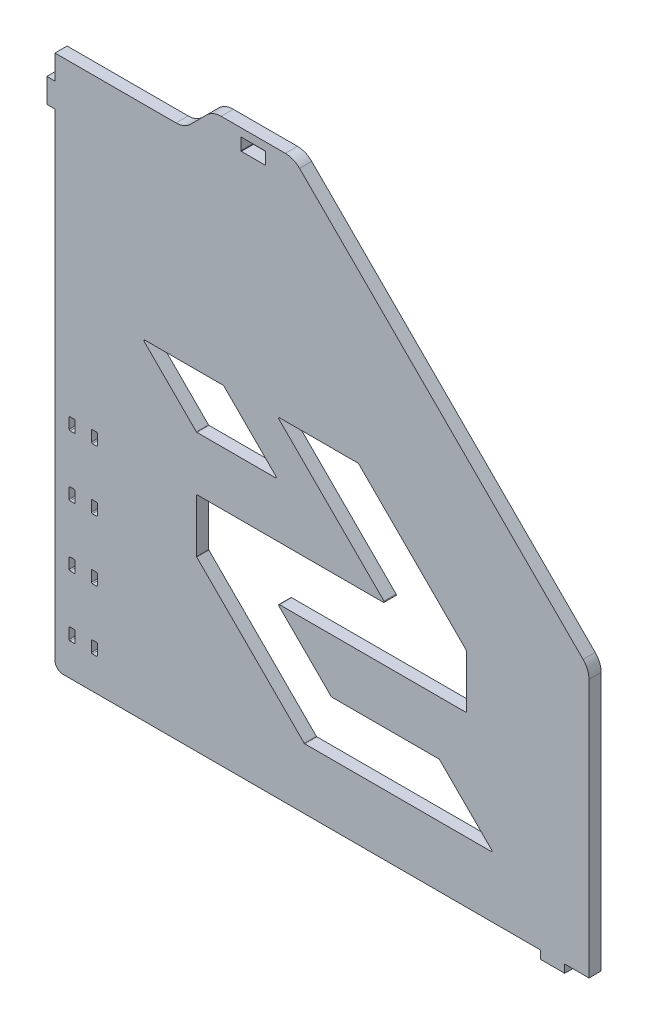
from build123d import *

# Parameters (mm, degrees)
BOSS_EXTRUDE1_DEPTH = 3
CUT_EXTRUDE2_REACH  = 101.081
CUT_EXTRUDE3_REACH  = 101.081
FILLET1_R           = 5
FILLET2_R           = 2
FILLET4_R           = 0.2


with BuildPart() as part:
    # Sketch1 → Boss-Extrude1 (new body)
    with BuildSketch(Plane.XY):
        Polygon((-34, 65), (-66, 65), (-66, 59), (-68, 59), (-68, 53), (-66, 53), (-66, -67), (54, -67), (54, -69), (60, -69), (60, -67), (66, -67), (66, -1), (-7, 72), (-27, 72), align=None)
        with BuildLine():
            ThreePointArc((-20.025, 69.925), (-20.018541435, 69.960355339), (-20, 69.991143783))
            Line((-20, 69.991143783), (-20, 70))
            Line((-20, 70), (-19.991143783, 70))
            ThreePointArc((-19.991143783, 70), (-19.960355339, 70.018541435), (-19.925, 70.025))
            Line((-19.925, 70.025), (-14.075, 70.025))
            ThreePointArc((-14.075, 70.025), (-14.039644661, 70.018541435), (-14.008856217, 70))
            Line((-14.008856217, 70), (-14, 70))
            Line((-14, 70), (-14, 69.991143783))
            ThreePointArc((-14, 69.991143783), (-13.981458565, 69.960355339), (-13.975, 69.925))
            Line((-13.975, 69.925), (-13.975, 67.075))
            ThreePointArc((-13.975, 67.075), (-13.981458565, 67.039644661), (-14, 67.008856217))
            Line((-14, 67.008856217), (-14, 67))
            Line((-14, 67), (-14.008856217, 67))
            ThreePointArc((-14.008856217, 67), (-14.039644661, 66.981458565), (-14.075, 66.975))
            Line((-14.075, 66.975), (-19.925, 66.975))
            ThreePointArc((-19.925, 66.975), (-19.960355339, 66.981458565), (-19.991143783, 67))
            Line((-19.991143783, 67), (-20, 67))
            Line((-20, 67), (-20, 67.008856217))
            ThreePointArc((-20, 67.008856217), (-20.018541435, 67.039644661), (-20.025, 67.075))
            Line((-20.025, 67.075), (-20.025, 69.925))
        make_face(mode=Mode.SUBTRACT)
    extrude(amount=BOSS_EXTRUDE1_DEPTH)

    # Sketch6 → Cut-Extrude2 (cut, up to next)
    with BuildSketch(Plane(origin=(0, 0, 0), x_dir=(-1, 0, 0), z_dir=(0, 0, -1)), mode=Mode.PRIVATE) as cut_extrude2_sk1:
        Polygon((31, 14.666666667), (17.666666667, 1.333333333), (31, 1.333333333), (44.333333333, 14.666666667), align=None)
    cut_extrude2_tool1 = extrude(cut_extrude2_sk1.sketch, amount=-CUT_EXTRUDE2_REACH, mode=Mode.PRIVATE) & part.part
    # Sketch6 → Cut-Extrude2 (cut, up to next)
    with BuildSketch(Plane(origin=(0, 0, 0), x_dir=(-1, 0, 0), z_dir=(0, 0, -1)), mode=Mode.PRIVATE) as cut_extrude2_sk2:
        Polygon((24.333333333, 14.666666667), (11, 1.333333333), (17.666666667, 1.333333333), (31, 14.666666667), align=None)
    cut_extrude2_tool2 = extrude(cut_extrude2_sk2.sketch, amount=-CUT_EXTRUDE2_REACH, mode=Mode.PRIVATE) & part.part
    # Sketch6 → Cut-Extrude2 (cut, up to next)
    with BuildSketch(Plane(origin=(0, 0, 0), x_dir=(-1, 0, 0), z_dir=(0, 0, -1)), mode=Mode.PRIVATE) as cut_extrude2_sk3:
        Polygon((-9, 14.666666667), (-22.333333333, 1.333333333), (-2.333333333, 1.333333333), (11, 14.666666667), align=None)
    cut_extrude2_tool3 = extrude(cut_extrude2_sk3.sketch, amount=-CUT_EXTRUDE2_REACH, mode=Mode.PRIVATE) & part.part
    # Sketch6 → Cut-Extrude2 (cut, up to next)
    with BuildSketch(Plane(origin=(0, 0, 0), x_dir=(-1, 0, 0), z_dir=(0, 0, -1)), mode=Mode.PRIVATE) as cut_extrude2_sk4:
        Polygon((-22.333333333, 1.333333333), (-35.666666667, -12), (-15.666666667, -12), (-2.333333333, 1.333333333), align=None)
    cut_extrude2_tool4 = extrude(cut_extrude2_sk4.sketch, amount=-CUT_EXTRUDE2_REACH, mode=Mode.PRIVATE) & part.part
    # Sketch6 → Cut-Extrude2 (cut, up to next)
    with BuildSketch(Plane(origin=(0, 0, 0), x_dir=(-1, 0, 0), z_dir=(0, 0, -1)), mode=Mode.PRIVATE) as cut_extrude2_sk5:
        Polygon((-35.666666667, -25.333333333), (-29, -25.333333333), (-15.666666667, -12), (-35.666666667, -12), align=None)
    cut_extrude2_tool5 = extrude(cut_extrude2_sk5.sketch, amount=-CUT_EXTRUDE2_REACH, mode=Mode.PRIVATE) & part.part
    # Sketch6 → Cut-Extrude2 (cut, up to next)
    with BuildSketch(Plane(origin=(0, 0, 0), x_dir=(-1, 0, 0), z_dir=(0, 0, -1)), mode=Mode.PRIVATE) as cut_extrude2_sk6:
        Polygon((-15.666666667, -12), (-29, -25.333333333), (-9, -25.333333333), (4.333333333, -12), align=None)
    cut_extrude2_tool6 = extrude(cut_extrude2_sk6.sketch, amount=-CUT_EXTRUDE2_REACH, mode=Mode.PRIVATE) & part.part
    # Sketch6 → Cut-Extrude2 (cut, up to next)
    with BuildSketch(Plane(origin=(0, 0, 0), x_dir=(-1, 0, 0), z_dir=(0, 0, -1)), mode=Mode.PRIVATE) as cut_extrude2_sk7:
        Polygon((4.333333333, -12), (-9, -25.333333333), (11, -25.333333333), (24.333333333, -12), align=None)
    cut_extrude2_tool7 = extrude(cut_extrude2_sk7.sketch, amount=-CUT_EXTRUDE2_REACH, mode=Mode.PRIVATE) & part.part
    # Sketch6 → Cut-Extrude2 (cut, up to next)
    with BuildSketch(Plane(origin=(0, 0, 0), x_dir=(-1, 0, 0), z_dir=(0, 0, -1)), mode=Mode.PRIVATE) as cut_extrude2_sk8:
        Polygon((24.333333333, -12), (11, -25.333333333), (31, -25.333333333), (31, -12), align=None)
    cut_extrude2_tool8 = extrude(cut_extrude2_sk8.sketch, amount=-CUT_EXTRUDE2_REACH, mode=Mode.PRIVATE) & part.part
    # Sketch6 → Cut-Extrude2 (cut, up to next)
    with BuildSketch(Plane(origin=(0, 0, 0), x_dir=(-1, 0, 0), z_dir=(0, 0, -1)), mode=Mode.PRIVATE) as cut_extrude2_sk9:
        Polygon((11, -25.333333333), (-2.333333333, -38.666666667), (17.666666667, -38.666666667), (31, -25.333333333), align=None)
    cut_extrude2_tool9 = extrude(cut_extrude2_sk9.sketch, amount=-CUT_EXTRUDE2_REACH, mode=Mode.PRIVATE) & part.part
    # Sketch6 → Cut-Extrude2 (cut, up to next)
    with BuildSketch(Plane(origin=(0, 0, 0), x_dir=(-1, 0, 0), z_dir=(0, 0, -1)), mode=Mode.PRIVATE) as cut_extrude2_sk10:
        Polygon((-2.333333333, -38.666666667), (-15.666666667, -52), (4.333333333, -52), (17.666666667, -38.666666667), align=None)
    cut_extrude2_tool10 = extrude(cut_extrude2_sk10.sketch, amount=-CUT_EXTRUDE2_REACH, mode=Mode.PRIVATE) & part.part
    # Sketch6 → Cut-Extrude2 (cut, up to next)
    with BuildSketch(Plane(origin=(0, 0, 0), x_dir=(-1, 0, 0), z_dir=(0, 0, -1)), mode=Mode.PRIVATE) as cut_extrude2_sk11:
        Polygon((-22.333333333, -38.666666667), (-35.666666667, -52), (-15.666666667, -52), (-2.333333333, -38.666666667), align=None)
    cut_extrude2_tool11 = extrude(cut_extrude2_sk11.sketch, amount=-CUT_EXTRUDE2_REACH, mode=Mode.PRIVATE) & part.part
    # Sketch6 → Cut-Extrude2 (cut, up to next)
    with BuildSketch(Plane(origin=(0, 0, 0), x_dir=(-1, 0, 0), z_dir=(0, 0, -1)), mode=Mode.PRIVATE) as cut_extrude2_sk12:
        Polygon((-29, -38.666666667), (-42.333333333, -52), (-35.666666667, -52), (-22.333333333, -38.666666667), align=None)
    cut_extrude2_tool12 = extrude(cut_extrude2_sk12.sketch, amount=-CUT_EXTRUDE2_REACH, mode=Mode.PRIVATE) & part.part
    add(cut_extrude2_tool1.solids().sort_by_distance((-31, 8, 0))[0], mode=Mode.SUBTRACT)
    add(cut_extrude2_tool2.solids().sort_by_distance((-21, 8, 0))[0], mode=Mode.SUBTRACT)
    add(cut_extrude2_tool3.solids().sort_by_distance((5.666667, 8, 0))[0], mode=Mode.SUBTRACT)
    add(cut_extrude2_tool4.solids().sort_by_distance((19, -5.333333, 0))[0], mode=Mode.SUBTRACT)
    add(cut_extrude2_tool5.solids().sort_by_distance((28.444444, -17.555556, 0))[0], mode=Mode.SUBTRACT)
    add(cut_extrude2_tool6.solids().sort_by_distance((12.333333, -18.666667, 0))[0], mode=Mode.SUBTRACT)
    add(cut_extrude2_tool7.solids().sort_by_distance((-7.666667, -18.666667, 0))[0], mode=Mode.SUBTRACT)
    add(cut_extrude2_tool8.solids().sort_by_distance((-23.777778, -19.777778, 0))[0], mode=Mode.SUBTRACT)
    add(cut_extrude2_tool9.solids().sort_by_distance((-14.333333, -32, 0))[0], mode=Mode.SUBTRACT)
    add(cut_extrude2_tool10.solids().sort_by_distance((-1, -45.333333, 0))[0], mode=Mode.SUBTRACT)
    add(cut_extrude2_tool11.solids().sort_by_distance((19, -45.333333, 0))[0], mode=Mode.SUBTRACT)
    add(cut_extrude2_tool12.solids().sort_by_distance((32.333333, -45.333333, 0))[0], mode=Mode.SUBTRACT)

    # Sketch7 → Cut-Extrude3 (cut, up to next)
    with BuildSketch(Plane.XY.offset(3), mode=Mode.PRIVATE) as cut_extrude3_sk1:
        with BuildLine():
            Line((-61, -58.75), (-61, -56.25))
            ThreePointArc((-61, -56.25), (-61.073223305, -56.073223305), (-61.25, -56))
            Line((-61.25, -56), (-62.25, -56))
            ThreePointArc((-62.25, -56), (-62.426776695, -56.073223305), (-62.5, -56.25))
            Line((-62.5, -56.25), (-62.5, -58.75))
            ThreePointArc((-62.5, -58.75), (-62.426776695, -58.926776695), (-62.25, -59))
            Line((-62.25, -59), (-61.25, -59))
            ThreePointArc((-61.25, -59), (-61.073223305, -58.926776695), (-61, -58.75))
        make_face()
    cut_extrude3_tool1 = extrude(cut_extrude3_sk1.sketch, amount=-CUT_EXTRUDE3_REACH, mode=Mode.PRIVATE) & part.part
    # Sketch7 → Cut-Extrude3 (cut, up to next)
    with BuildSketch(Plane.XY.offset(3), mode=Mode.PRIVATE) as cut_extrude3_sk2:
        with BuildLine():
            ThreePointArc((-56.75, -56), (-56.926776695, -56.073223305), (-57, -56.25))
            Line((-57, -56.25), (-57, -58.75))
            ThreePointArc((-57, -58.75), (-56.926776695, -58.926776695), (-56.75, -59))
            Line((-56.75, -59), (-55.75, -59))
            ThreePointArc((-55.75, -59), (-55.573223305, -58.926776695), (-55.5, -58.75))
            Line((-55.5, -58.75), (-55.5, -56.25))
            ThreePointArc((-55.5, -56.25), (-55.573223305, -56.073223305), (-55.75, -56))
            Line((-55.75, -56), (-56.75, -56))
        make_face()
    cut_extrude3_tool2 = extrude(cut_extrude3_sk2.sketch, amount=-CUT_EXTRUDE3_REACH, mode=Mode.PRIVATE) & part.part
    # Sketch7 → Cut-Extrude3 (cut, up to next)
    with BuildSketch(Plane.XY.offset(3), mode=Mode.PRIVATE) as cut_extrude3_sk3:
        with BuildLine():
            ThreePointArc((-56.75, -41), (-56.926776695, -41.073223305), (-57, -41.25))
            Line((-57, -41.25), (-57, -43.75))
            ThreePointArc((-57, -43.75), (-56.926776695, -43.926776695), (-56.75, -44))
            Line((-56.75, -44), (-55.75, -44))
            ThreePointArc((-55.75, -44), (-55.573223305, -43.926776695), (-55.5, -43.75))
            Line((-55.5, -43.75), (-55.5, -41.25))
            ThreePointArc((-55.5, -41.25), (-55.573223305, -41.073223305), (-55.75, -41))
            Line((-55.75, -41), (-56.75, -41))
        make_face()
    cut_extrude3_tool3 = extrude(cut_extrude3_sk3.sketch, amount=-CUT_EXTRUDE3_REACH, mode=Mode.PRIVATE) & part.part
    # Sketch7 → Cut-Extrude3 (cut, up to next)
    with BuildSketch(Plane.XY.offset(3), mode=Mode.PRIVATE) as cut_extrude3_sk4:
        with BuildLine():
            Line((-61, -43.75), (-61, -41.25))
            ThreePointArc((-61, -41.25), (-61.073223305, -41.073223305), (-61.25, -41))
            Line((-61.25, -41), (-62.25, -41))
            ThreePointArc((-62.25, -41), (-62.426776695, -41.073223305), (-62.5, -41.25))
            Line((-62.5, -41.25), (-62.5, -43.75))
            ThreePointArc((-62.5, -43.75), (-62.426776695, -43.926776695), (-62.25, -44))
            Line((-62.25, -44), (-61.25, -44))
            ThreePointArc((-61.25, -44), (-61.073223305, -43.926776695), (-61, -43.75))
        make_face()
    cut_extrude3_tool4 = extrude(cut_extrude3_sk4.sketch, amount=-CUT_EXTRUDE3_REACH, mode=Mode.PRIVATE) & part.part
    # Sketch7 → Cut-Extrude3 (cut, up to next)
    with BuildSketch(Plane.XY.offset(3), mode=Mode.PRIVATE) as cut_extrude3_sk5:
        with BuildLine():
            Line((-61, -28.75), (-61, -26.25))
            ThreePointArc((-61, -26.25), (-61.073223305, -26.073223305), (-61.25, -26))
            Line((-61.25, -26), (-62.25, -26))
            ThreePointArc((-62.25, -26), (-62.426776695, -26.073223305), (-62.5, -26.25))
            Line((-62.5, -26.25), (-62.5, -28.75))
            ThreePointArc((-62.5, -28.75), (-62.426776695, -28.926776695), (-62.25, -29))
            Line((-62.25, -29), (-61.25, -29))
            ThreePointArc((-61.25, -29), (-61.073223305, -28.926776695), (-61, -28.75))
        make_face()
    cut_extrude3_tool5 = extrude(cut_extrude3_sk5.sketch, amount=-CUT_EXTRUDE3_REACH, mode=Mode.PRIVATE) & part.part
    # Sketch7 → Cut-Extrude3 (cut, up to next)
    with BuildSketch(Plane.XY.offset(3), mode=Mode.PRIVATE) as cut_extrude3_sk6:
        with BuildLine():
            ThreePointArc((-56.75, -26), (-56.926776695, -26.073223305), (-57, -26.25))
            Line((-57, -26.25), (-57, -28.75))
            ThreePointArc((-57, -28.75), (-56.926776695, -28.926776695), (-56.75, -29))
            Line((-56.75, -29), (-55.75, -29))
            ThreePointArc((-55.75, -29), (-55.573223305, -28.926776695), (-55.5, -28.75))
            Line((-55.5, -28.75), (-55.5, -26.25))
            ThreePointArc((-55.5, -26.25), (-55.573223305, -26.073223305), (-55.75, -26))
            Line((-55.75, -26), (-56.75, -26))
        make_face()
    cut_extrude3_tool6 = extrude(cut_extrude3_sk6.sketch, amount=-CUT_EXTRUDE3_REACH, mode=Mode.PRIVATE) & part.part
    # Sketch7 → Cut-Extrude3 (cut, up to next)
    with BuildSketch(Plane.XY.offset(3), mode=Mode.PRIVATE) as cut_extrude3_sk7:
        with BuildLine():
            Line((-61, -13.75), (-61, -11.25))
            ThreePointArc((-61, -11.25), (-61.073223305, -11.073223305), (-61.25, -11))
            Line((-61.25, -11), (-62.25, -11))
            ThreePointArc((-62.25, -11), (-62.426776695, -11.073223305), (-62.5, -11.25))
            Line((-62.5, -11.25), (-62.5, -13.75))
            ThreePointArc((-62.5, -13.75), (-62.426776695, -13.926776695), (-62.25, -14))
            Line((-62.25, -14), (-61.25, -14))
            ThreePointArc((-61.25, -14), (-61.073223305, -13.926776695), (-61, -13.75))
        make_face()
    cut_extrude3_tool7 = extrude(cut_extrude3_sk7.sketch, amount=-CUT_EXTRUDE3_REACH, mode=Mode.PRIVATE) & part.part
    # Sketch7 → Cut-Extrude3 (cut, up to next)
    with BuildSketch(Plane.XY.offset(3), mode=Mode.PRIVATE) as cut_extrude3_sk8:
        with BuildLine():
            ThreePointArc((-56.75, -11), (-56.926776695, -11.073223305), (-57, -11.25))
            Line((-57, -11.25), (-57, -13.75))
            ThreePointArc((-57, -13.75), (-56.926776695, -13.926776695), (-56.75, -14))
            Line((-56.75, -14), (-55.75, -14))
            ThreePointArc((-55.75, -14), (-55.573223305, -13.926776695), (-55.5, -13.75))
            Line((-55.5, -13.75), (-55.5, -11.25))
            ThreePointArc((-55.5, -11.25), (-55.573223305, -11.073223305), (-55.75, -11))
            Line((-55.75, -11), (-56.75, -11))
        make_face()
    cut_extrude3_tool8 = extrude(cut_extrude3_sk8.sketch, amount=-CUT_EXTRUDE3_REACH, mode=Mode.PRIVATE) & part.part
    add(cut_extrude3_tool1.solids().sort_by_distance((-61.75, -57.5, 3))[0], mode=Mode.SUBTRACT)
    add(cut_extrude3_tool2.solids().sort_by_distance((-56.25, -57.5, 3))[0], mode=Mode.SUBTRACT)
    add(cut_extrude3_tool3.solids().sort_by_distance((-56.25, -42.5, 3))[0], mode=Mode.SUBTRACT)
    add(cut_extrude3_tool4.solids().sort_by_distance((-61.75, -42.5, 3))[0], mode=Mode.SUBTRACT)
    add(cut_extrude3_tool5.solids().sort_by_distance((-61.75, -27.5, 3))[0], mode=Mode.SUBTRACT)
    add(cut_extrude3_tool6.solids().sort_by_distance((-56.25, -27.5, 3))[0], mode=Mode.SUBTRACT)
    add(cut_extrude3_tool7.solids().sort_by_distance((-61.75, -12.5, 3))[0], mode=Mode.SUBTRACT)
    add(cut_extrude3_tool8.solids().sort_by_distance((-56.25, -12.5, 3))[0], mode=Mode.SUBTRACT)

    # Fillet1
    fillet1_edges = [part.edges().sort_by_distance(p)[0] for p in [
        (66, -1, 1.5),
        (-34, 65, 1.5),
        (-27, 72, 1.5),
        (-7, 72, 1.5),
    ]]
    fillet(fillet1_edges, radius=FILLET1_R)

    # Fillet2
    fillet2_edges = [part.edges().sort_by_distance(p)[0] for p in [
        (-66, -67, 1.5),
    ]]
    fillet(fillet2_edges, radius=FILLET2_R)

    # Fillet4
    fillet4_edges = [part.edges().sort_by_distance(p)[0] for p in [
        (35.666666667, -12, 1.5),
        (9, 14.666666667, 1.5),
        (-11, 14.666666667, 1.5),
        (15.666666667, -12, 1.5),
        (-31, -12, 1.5),
        (-31, -25.333333333, 1.5),
        (-4.333333333, -52, 1.5),
        (42.333333333, -52, 1.5),
        (29, -38.666666667, 1.5),
        (2.333333333, -38.666666667, 1.5),
        (-11, -25.333333333, 1.5),
        (35.666666667, -25.333333333, 1.5),
        (-31, 1.333333333, 1.5),
        (-11, 1.333333333, 1.5),
        (-24.333333333, 14.666666667, 1.5),
        (-44.333333333, 14.666666667, 1.5),
    ]]
    fillet(fillet4_edges, radius=FILLET4_R)


solid = part.part
